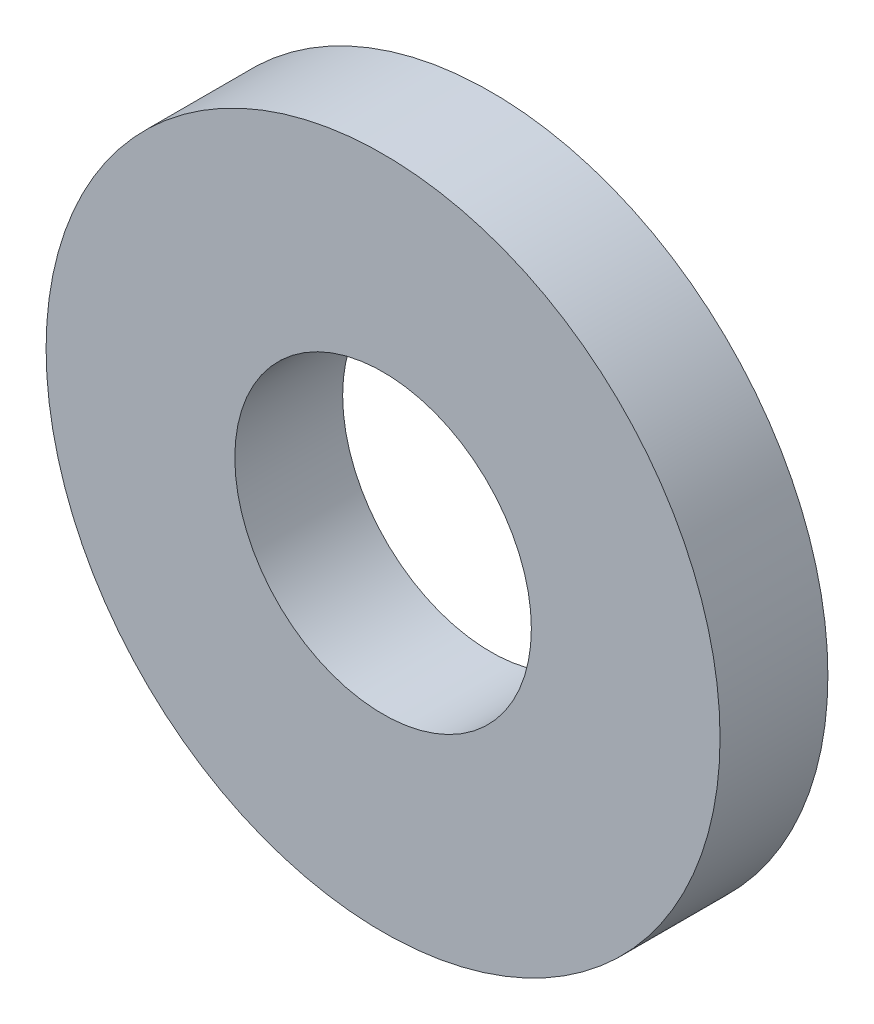
from build123d import *

# Parameters (mm, degrees)
SKETCH3_R           = 2.5
SKETCH3_R_2         = 1.1
BOSS_EXTRUDE1_DEPTH = 0.8


with BuildPart() as part:
    # Sketch3 → Boss-Extrude1 (new body)
    with BuildSketch(Plane.XY):
        Circle(SKETCH3_R)
        Circle(SKETCH3_R_2, mode=Mode.SUBTRACT)
    extrude(amount=-BOSS_EXTRUDE1_DEPTH)


solid = part.part
